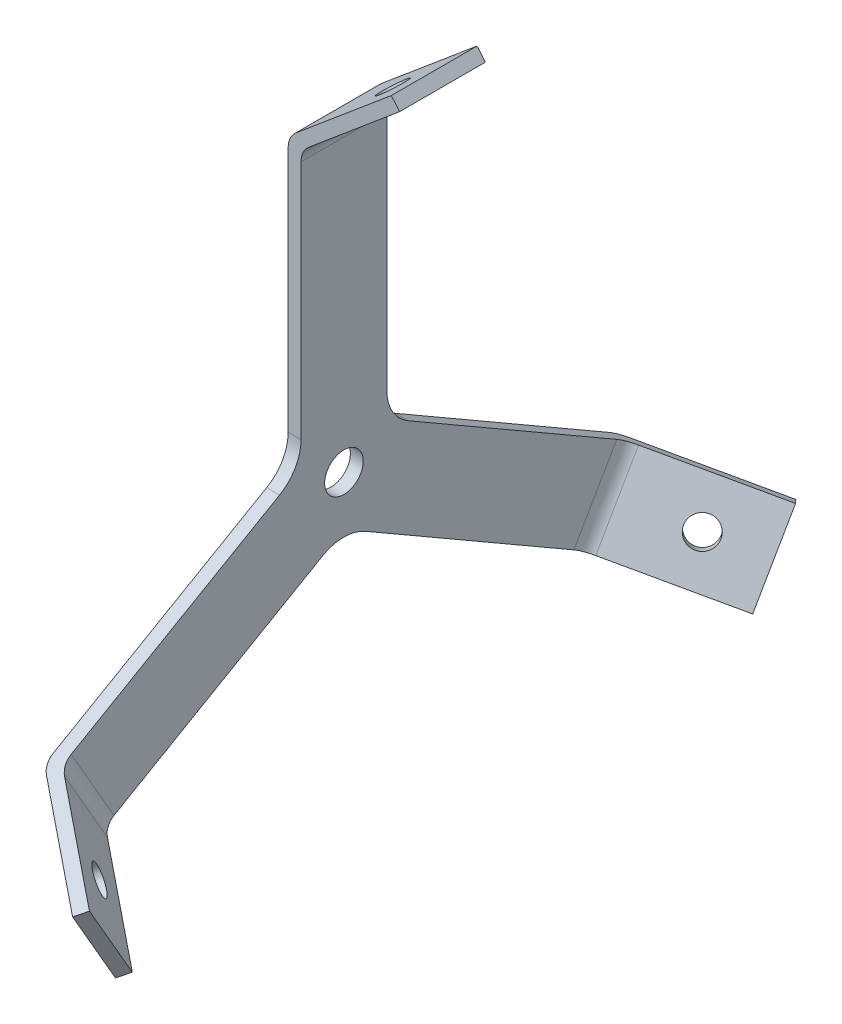
from build123d import *

# Parameters (mm, degrees)
EXTRUDE_1_DEPTH          = 10
PATTERN_CIRCULAR_1_COUNT = 3
FILLET_2_R               = 10
HOLE_WIZARD_M82_D        = 9
HOLE_WIZARD_M61_D        = 6.6
PATTERN_CIRCULAR_2_COUNT = 3


with BuildPart() as part:
    # Эскиз1 → Бобышка-Вытянуть1 (new, symmetric)
    with BuildSketch(Plane.XY):
        with BuildLine():
            Line((0, 0), (0, 69.067384684))
            ThreePointArc((0, 69.067384684), (0.468461065, 71.180475992), (1.786061952, 72.897606899))
            Line((1.786061952, 72.897606899), (24.052970465, 91.58176162))
            Line((24.052970465, 91.58176162), (25.981333294, 89.283628291))
            Line((25.981333294, 89.283628291), (4.786061952, 71.498683925))
            ThreePointArc((4.786061952, 71.498683925), (3.468461065, 69.781553018), (3, 67.668461709))
            Line((3, 67.668461709), (3, 0))
            Line((3, 0), (0, 0))
        make_face()
    extrude_1 = extrude(amount=EXTRUDE_1_DEPTH, both=True)

    # Круговой массив1: Бобышка-Вытянуть1 ×3 about axis
    pattern_circular_1_axis = Axis((-26.581598466, 0, 0), (1, 0, 0))
    for i in range(1, PATTERN_CIRCULAR_1_COUNT):
        add(extrude_1.rotate(pattern_circular_1_axis, i * 360 / PATTERN_CIRCULAR_1_COUNT))

    # Скругление2
    fillet_2_edges = [part.edges().sort_by_distance(p)[0] for p in [
        (1.5, 5.773502692, 10),
        (1.5, -11.547005384, 0),
        (1.5, 5.773502692, -10),
    ]]
    fillet(fillet_2_edges, radius=FILLET_2_R)

    # Отверстие с зазором M82 (through all)
    with Locations(Plane(origin=(0, 0, 0), x_dir=(0, 0, -1), z_dir=(-1, 0, 0))):
        with Locations((0, 0)):
            Hole(HOLE_WIZARD_M82_D / 2)

    # Отверстие с зазором M61 (through all)
    with Locations(Plane(origin=(16.276728598, 81.14049807, 0), x_dir=(-0.766044443119, -0.642787609687, 0), z_dir=(0.642787609687, -0.766044443119, 0))):
        with Locations((0, 0)):
            hole_wizard_m61 = Hole(HOLE_WIZARD_M61_D / 2)

    # Круговой массив2: Отверстие с зазором M61 ×3 about axis
    pattern_circular_2_axis = Axis((22.676850282, 0, 0), (-1, 0, 0))
    for i in range(1, PATTERN_CIRCULAR_2_COUNT):
        add(hole_wizard_m61.rotate(pattern_circular_2_axis, i * 360 / PATTERN_CIRCULAR_2_COUNT), mode=Mode.SUBTRACT)


solid = part.part
